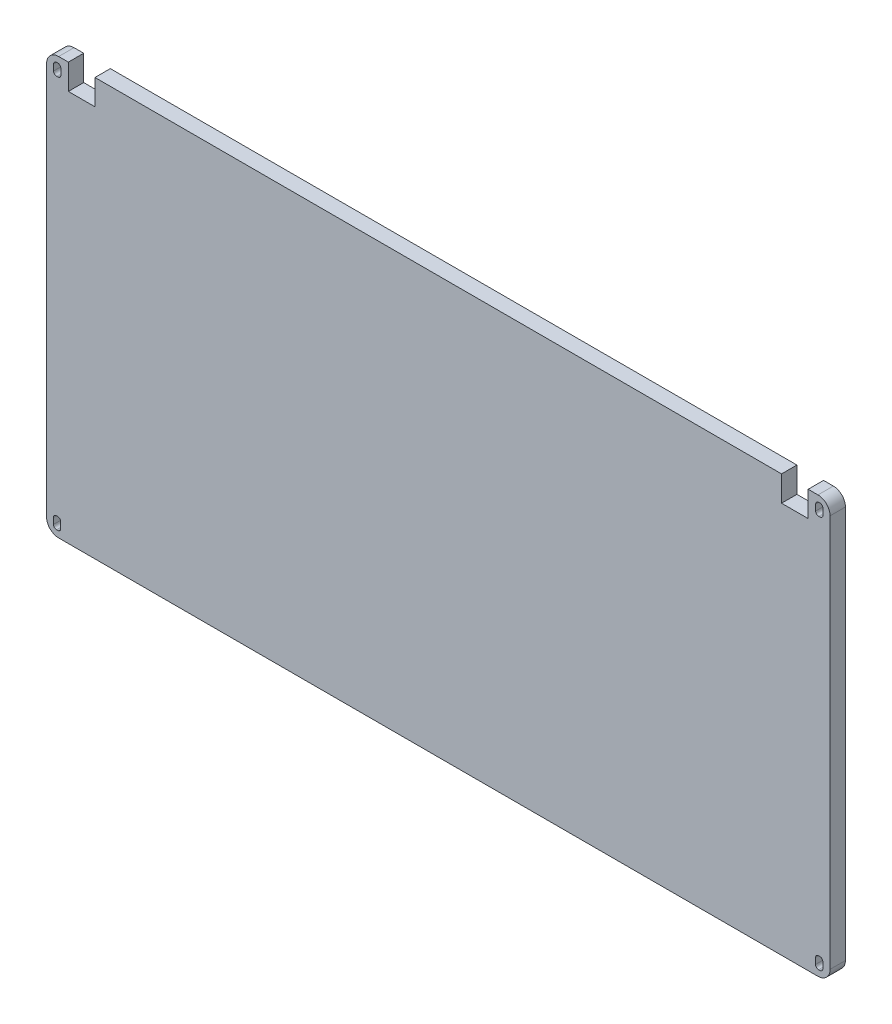
from build123d import *

# Parameters (mm, degrees)
BOSS_EXTRUDE1_DEPTH = 12.7
FILLET1_R           = 10


with BuildPart() as part:
    # Sketch1 → Boss-Extrude1 (new body)
    with BuildSketch(Plane.XY):
        Polygon((307.625143269, 169.700104384), (325.725145069, 169.700104384), (325.725145069, -174.977895616), (-321.974854931, -174.977895616), (-321.974854931, 169.700104384), (-303.974854931, 169.700104384), (-303.974854931, 148.700104384), (-281.974854931, 148.700104384), (-281.974854931, 169.700104384), (285.625143269, 169.700104384), (285.625143269, 148.700104384), (307.625143269, 148.700104384), align=None)
        with BuildLine():
            Line((317.221591679, -169.977895616), (316.221591679, -169.977895616))
            ThreePointArc((316.221591679, -169.977895616), (314.453824726, -169.245662569), (313.721591679, -167.477895616))
            Line((313.721591679, -167.477895616), (313.721591679, -162.477895616))
            ThreePointArc((313.721591679, -162.477895616), (314.453824726, -160.710128663), (316.221591679, -159.977895616))
            Line((316.221591679, -159.977895616), (317.221591679, -159.977895616))
            ThreePointArc((317.221591679, -159.977895616), (318.989358632, -160.710128663), (319.721591679, -162.477895616))
            Line((319.721591679, -162.477895616), (319.721591679, -167.477895616))
            ThreePointArc((319.721591679, -167.477895616), (318.989358632, -169.245662569), (317.221591679, -169.977895616))
        make_face(mode=Mode.SUBTRACT)
        with BuildLine():
            Line((-312.778408321, -169.977895616), (-313.778408321, -169.977895616))
            ThreePointArc((-313.778408321, -169.977895616), (-315.546175274, -169.245662569), (-316.278408321, -167.477895616))
            Line((-316.278408321, -167.477895616), (-316.278408321, -162.477895616))
            ThreePointArc((-316.278408321, -162.477895616), (-315.546175274, -160.710128663), (-313.778408321, -159.977895616))
            Line((-313.778408321, -159.977895616), (-312.778408321, -159.977895616))
            ThreePointArc((-312.778408321, -159.977895616), (-311.010641368, -160.710128663), (-310.278408321, -162.477895616))
            Line((-310.278408321, -162.477895616), (-310.278408321, -167.477895616))
            ThreePointArc((-310.278408321, -167.477895616), (-311.010641368, -169.245662569), (-312.778408321, -169.977895616))
        make_face(mode=Mode.SUBTRACT)
        with BuildLine():
            Line((-312.674854931, 154.702104384), (-313.674854931, 154.702104384))
            ThreePointArc((-313.674854931, 154.702104384), (-315.442621884, 155.434337431), (-316.174854931, 157.202104384))
            Line((-316.174854931, 157.202104384), (-316.174854931, 162.202104384))
            ThreePointArc((-316.174854931, 162.202104384), (-315.442621884, 163.969871337), (-313.674854931, 164.702104384))
            Line((-313.674854931, 164.702104384), (-312.674854931, 164.702104384))
            ThreePointArc((-312.674854931, 164.702104384), (-310.907087978, 163.969871337), (-310.174854931, 162.202104384))
            Line((-310.174854931, 162.202104384), (-310.174854931, 157.202104384))
            ThreePointArc((-310.174854931, 157.202104384), (-310.907087978, 155.434337431), (-312.674854931, 154.702104384))
        make_face(mode=Mode.SUBTRACT)
        with BuildLine():
            Line((317.325145069, 154.702104384), (316.325145069, 154.702104384))
            ThreePointArc((316.325145069, 154.702104384), (314.557378116, 155.434337431), (313.825145069, 157.202104384))
            Line((313.825145069, 157.202104384), (313.825145069, 162.202104384))
            ThreePointArc((313.825145069, 162.202104384), (314.557378116, 163.969871337), (316.325145069, 164.702104384))
            Line((316.325145069, 164.702104384), (317.325145069, 164.702104384))
            ThreePointArc((317.325145069, 164.702104384), (319.092912022, 163.969871337), (319.825145069, 162.202104384))
            Line((319.825145069, 162.202104384), (319.825145069, 157.202104384))
            ThreePointArc((319.825145069, 157.202104384), (319.092912022, 155.434337431), (317.325145069, 154.702104384))
        make_face(mode=Mode.SUBTRACT)
    extrude(amount=BOSS_EXTRUDE1_DEPTH)

    # Fillet1
    fillet1_edges = [part.edges().sort_by_distance(p)[0] for p in [
        (-321.974854931, 169.700104384, 6.35),
        (-321.974854931, -174.977895616, 6.35),
        (325.725145069, -174.977895616, 6.35),
        (325.725145069, 169.700104384, 6.35),
    ]]
    fillet(fillet1_edges, radius=FILLET1_R)


solid = part.part
